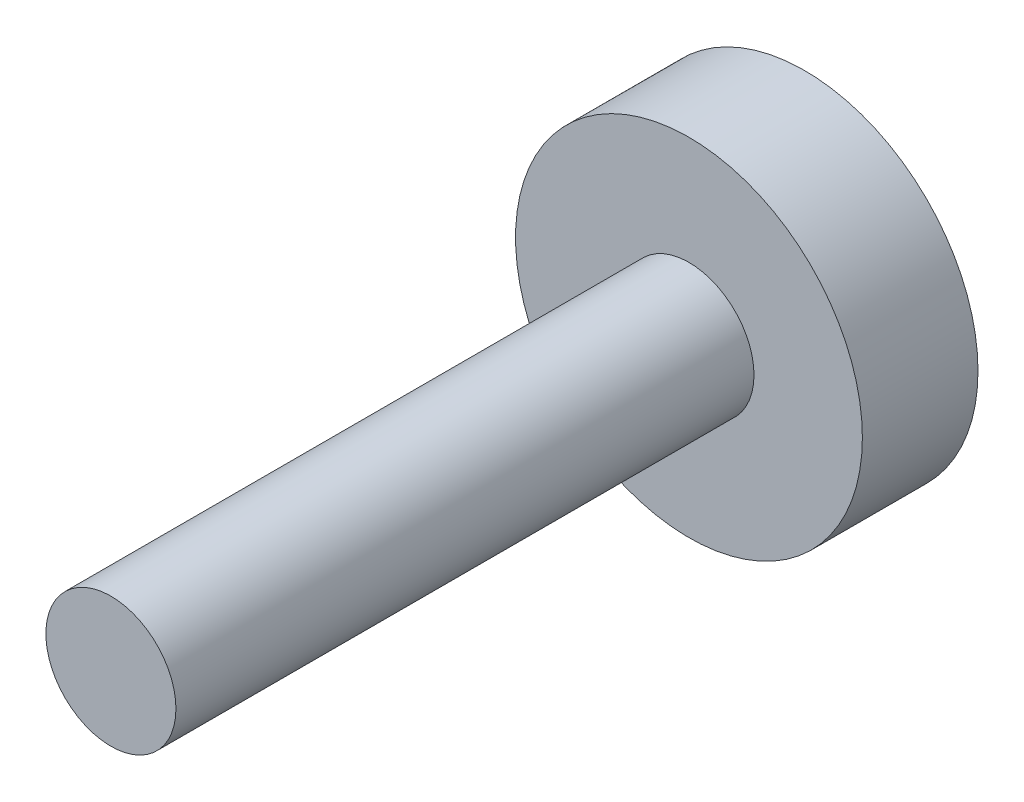
from build123d import *

# Parameters (mm, degrees)
SKETCH1_R           = 1.125
BOSS_EXTRUDE1_DEPTH = 12
SKETCH1_3_R         = 3
SKETCH1_3_R_2       = 1.125
BOSS_EXTRUDE2_DEPTH = 2


with BuildPart() as part:
    # Sketch1 → Boss-Extrude1 (new body)
    with BuildSketch(Plane.XY):
        Circle(SKETCH1_R)
    extrude(amount=BOSS_EXTRUDE1_DEPTH)

    # Sketch1<3> → Boss-Extrude2 (add)
    with BuildSketch(Plane.XY):
        Circle(SKETCH1_3_R)
        Circle(SKETCH1_3_R_2, mode=Mode.SUBTRACT)
    extrude(amount=BOSS_EXTRUDE2_DEPTH)


solid = part.part
